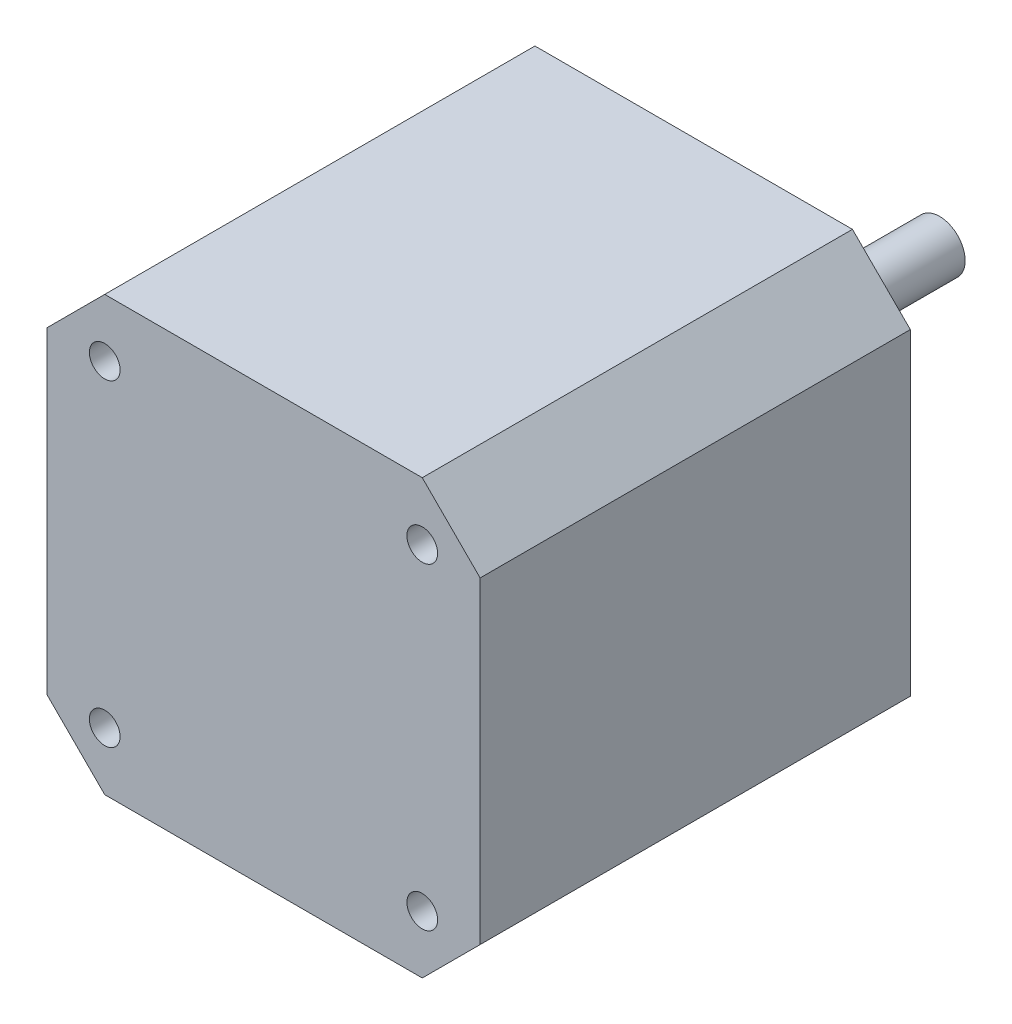
from build123d import *

# Parameters (mm, degrees)
SKETCH1_R           = 1.5
BOSS_EXTRUDE1_DEPTH = 42


with BuildPart() as part:
    # Sketch1 → Boss-Extrude1 (new body)
    with BuildSketch(Plane.XY):
        Polygon((-15.5, 21.15), (-21.15, 15.5), (-21.15, -15.5), (-15.5, -21.15), (15.5, -21.15), (21.15, -15.5), (21.15, 15.5), (15.5, 21.15), align=None)
        with Locations((15.5, 15.5)):
            Circle(SKETCH1_R, mode=Mode.SUBTRACT)
        with Locations((15.5, -15.5)):
            Circle(SKETCH1_R, mode=Mode.SUBTRACT)
        with Locations((-15.5, -15.5)):
            Circle(SKETCH1_R, mode=Mode.SUBTRACT)
        with Locations((-15.5, 15.5)):
            Circle(SKETCH1_R, mode=Mode.SUBTRACT)
    extrude(amount=BOSS_EXTRUDE1_DEPTH)

    # Sketch3 → Revolve1 (revolve)
    with BuildSketch(Plane(origin=(0, 0, 0), x_dir=(0, 0, -1), z_dir=(1, 0, 0)), mode=Mode.PRIVATE) as revolve1_sk:
        Polygon((0, 0), (24, 0), (24, 2.5), (2, 2.5), (2, 11), (0, 11), align=None)
    revolve(revolve1_sk.sketch.rotate(Axis((0, 0, 0), (0, 0, -1)), 90), axis=Axis((0, 0, 0), (0, 0, -1)))


solid = part.part
